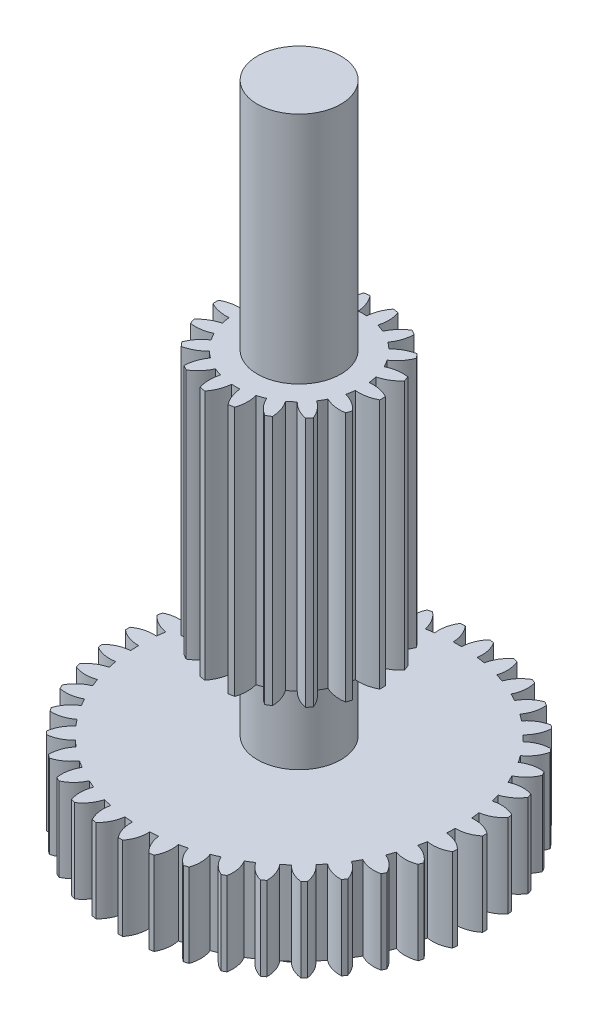
from build123d import *

# Parameters (mm, degrees)
BOSS_EXTRUDE1_DEPTH      = 1
BOSS_EXTRUDE2_DEPTH      = 6.8
BOSS_EXTRUDE2_DEPTH_BACK = 2
SKETCH2_R                = 0.5
SKETCH3_R                = 1
BOSS_EXTRUDE3_DEPTH      = 3
SKETCH4_OUTSIDE_W        = 8.414
SKETCH4_OUTSIDE_H        = 8.411
CUT_EXTRUDE1_DEPTH       = 3


with BuildPart() as part:
    # Sketch1 → Boss-Extrude1 (new body)
    with BuildSketch(Plane(origin=(0, 0, 0), x_dir=(1, 0, 0), z_dir=(0, 1, 0))):
        with BuildLine():
            ThreePointArc((-1.398553175, 1.619768198), (-1.419082489, 1.601813001), (-1.439381308, 1.583597629))
            ThreePointArc((-1.439381308, 1.583597629), (-1.407018105, 1.456632634), (-1.332288063, 1.349008716))
            ThreePointArc((-1.332288063, 1.349008716), (-1.36739984, 1.313405374), (-1.401560499, 1.276888471))
            ThreePointArc((-1.401560499, 1.276888471), (-1.512106209, 1.347224329), (-1.64027137, 1.374448919))
            ThreePointArc((-1.64027137, 1.374448919), (-1.657654618, 1.353433104), (-1.674768622, 1.332197457))
            ThreePointArc((-1.674768622, 1.332197457), (-1.622457897, 1.212068048), (-1.531431499, 1.117825373))
            ThreePointArc((-1.531431499, 1.117825373), (-1.56037741, 1.07705076), (-1.588237974, 1.035526986))
            ThreePointArc((-1.588237974, 1.035526986), (-1.708634811, 1.087219234), (-1.839507398, 1.093532136))
            ThreePointArc((-1.839507398, 1.093532136), (-1.853294364, 1.07), (-1.866780308, 1.04629407))
            ThreePointArc((-1.866780308, 1.04629407), (-1.795876881, 0.936111535), (-1.690911663, 0.857690939))
            ThreePointArc((-1.690911663, 0.857690939), (-1.712942024, 0.812801096), (-1.733780919, 0.767345896))
            ThreePointArc((-1.733780919, 0.767345896), (-1.860910669, 0.799055731), (-1.991101151, 0.784293444))
            ThreePointArc((-1.991101151, 0.784293444), (-2.000934759, 0.758854458), (-2.010443366, 0.733292216))
            ThreePointArc((-2.010443366, 0.733292216), (-1.922783598, 0.635910226), (-1.806598103, 0.575342761))
            ThreePointArc((-1.806598103, 0.575342761), (-1.82114234, 0.527500312), (-1.83441985, 0.47929095))
            ThreePointArc((-1.83441985, 0.47929095), (-1.964989918, 0.490197106), (-2.09112643, 0.454741964))
            ThreePointArc((-2.09112643, 0.454741964), (-2.096751995, 0.428054985), (-2.102036996, 0.401298479))
            ThreePointArc((-2.102036996, 0.401298479), (-1.999891229, 0.319239176), (-1.875494602, 0.278093508))
            ThreePointArc((-1.875494602, 0.278093508), (-1.882176025, 0.228537546), (-1.88754827, 0.17882262))
            ThreePointArc((-1.88754827, 0.17882262), (-2.01817696, 0.168642632), (-2.136992633, 0.113412905))
            ThreePointArc((-2.136992633, 0.113412905), (-2.138264456, 0.086169112), (-2.139188972, 0.058911322))
            ThreePointArc((-2.139188972, 0.058911322), (-2.025202728, -0.005700001), (-1.895816775, -0.026358221))
            ThreePointArc((-1.895816775, -0.026358221), (-1.894462341, -0.076344222), (-1.891790181, -0.126277121))
            ThreePointArc((-1.891790181, -0.126277121), (-2.019094279, -0.157279597), (-2.127511849, -0.230853487))
            ThreePointArc((-2.127511849, -0.230853487), (-2.124396991, -0.257948496), (-2.120937077, -0.285001607))
            ThreePointArc((-2.120937077, -0.285001607), (-1.99806254, -0.330491551), (-1.86703829, -0.330127286))
            ThreePointArc((-1.86703829, -0.330127286), (-1.857683076, -0.379248715), (-1.84703572, -0.428106352))
            ThreePointArc((-1.84703572, -0.428106352), (-1.967718117, -0.479128367), (-2.062929626, -0.569140896))
            ThreePointArc((-2.062929626, -0.569140896), (-2.055508759, -0.595385373), (-2.047754026, -0.621533144))
            ThreePointArc((-2.047754026, -0.621533144), (-1.919173582, -0.646723544), (-1.789904493, -0.625346228))
            ThreePointArc((-1.789904493, -0.625346228), (-1.772790796, -0.672330866), (-1.754444005, -0.718847852))
            ThreePointArc((-1.754444005, -0.718847852), (-1.865379089, -0.788567964), (-1.944918609, -0.892687854))
            ThreePointArc((-1.944918609, -0.892687854), (-1.93338393, -0.917402081), (-1.921535221, -0.941967299))
            ThreePointArc((-1.921535221, -0.941967299), (-1.790579036, -0.946205736), (-1.666413111, -0.904369031))
            ThreePointArc((-1.666413111, -0.904369031), (-1.641984166, -0.948), (-1.616413111, -0.990971572))
            ThreePointArc((-1.616413111, -0.990971572), (-1.714727723, -1.077584065), (-1.776535221, -1.193114666))
            ThreePointArc((-1.776535221, -1.193114666), (-1.761185473, -1.215658558), (-1.745549664, -1.238004996))
            ThreePointArc((-1.745549664, -1.238004996), (-1.615609434, -1.221181697), (-1.499762504, -1.159969151))
            ThreePointArc((-1.499762504, -1.159969151), (-1.468651008, -1.199116432), (-1.436517966, -1.237429647))
            ThreePointArc((-1.436517966, -1.237429647), (-1.519665809, -1.338691304), (-1.562140505, -1.462640435))
            ThreePointArc((-1.562140505, -1.462640435), (-1.543373237, -1.482430117), (-1.524355287, -1.501979014))
            ThreePointArc((-1.524355287, -1.501979014), (-1.398796396, -1.464529693), (-1.294268836, -1.38552668))
            ThreePointArc((-1.294268836, -1.38552668), (-1.25728056, -1.419176379), (-1.219417761, -1.451838945))
            ThreePointArc((-1.219417761, -1.451838945), (-1.285245349, -1.565127142), (-1.30728717, -1.694284585))
            ThreePointArc((-1.30728717, -1.694284585), (-1.285588445, -1.710807514), (-1.263680909, -1.727052564))
            ThreePointArc((-1.263680909, -1.727052564), (-1.145755266, -1.66994714), (-1.055254285, -1.575199795))
            ThreePointArc((-1.055254285, -1.575199795), (-1.013347206, -1.602480402), (-0.970735277, -1.628646377))
            ThreePointArc((-0.970735277, -1.628646377), (-1.01753771, -1.75102701), (-1.018575784, -1.882047654))
            ThreePointArc((-1.018575784, -1.882047654), (-0.994507588, -1.894875895), (-0.970277859, -1.90739636))
            ThreePointArc((-0.970277859, -1.90739636), (-0.863039676, -1.832113833), (-0.788909203, -1.724076063))
            ThreePointArc((-0.788909203, -1.724076063), (-0.743168692, -1.744281025), (-0.696911258, -1.763272724))
            ThreePointArc((-0.696911258, -1.763272724), (-0.723476378, -1.891576197), (-0.703483821, -2.021066677))
            ThreePointArc((-0.703483821, -2.021066677), (-0.677669507, -2.029867986), (-0.651745122, -2.038339593))
            ThreePointArc((-0.651745122, -2.038339593), (-0.557971812, -1.94682974), (-0.502131786, -1.828299666))
            ThreePointArc((-0.502131786, -1.828299666), (-0.453742499, -1.840905686), (-0.405037604, -1.852231233))
            ThreePointArc((-0.405037604, -1.852231233), (-0.410677389, -1.983134555), (-0.370171995, -2.107741135))
            ThreePointArc((-0.370171995, -2.107741135), (-0.343280141, -2.112287562), (-0.316332529, -2.1164909))
            ThreePointArc((-0.316332529, -2.1164909), (-0.238452772, -2.011123779), (-0.20234942, -1.885171269))
            ThreePointArc((-0.20234942, -1.885171269), (-0.152564614, -1.889851856), (-0.102673689, -1.893217926))
            ThreePointArc((-0.102673689, -1.893217926), (-0.08724207, -2.023330769), (-0.02727291, -2.139826205))
            ThreePointArc((-0.02727291, -2.139826205), (0, -2.14), (0.02727291, -2.139826205))
            ThreePointArc((0.02727291, -2.139826205), (0.08724207, -2.023330769), (0.102673689, -1.893217926))
            ThreePointArc((0.102673689, -1.893217926), (0.152564614, -1.889851856), (0.20234942, -1.885171269))
            ThreePointArc((0.20234942, -1.885171269), (0.238452772, -2.011123779), (0.316332529, -2.1164909))
            ThreePointArc((0.316332529, -2.1164909), (0.343280141, -2.112287562), (0.370171995, -2.107741135))
            ThreePointArc((0.370171995, -2.107741135), (0.410677389, -1.983134555), (0.405037604, -1.852231233))
            ThreePointArc((0.405037604, -1.852231233), (0.453742499, -1.840905686), (0.502131786, -1.828299666))
            ThreePointArc((0.502131786, -1.828299666), (0.557971812, -1.94682974), (0.651745122, -2.038339593))
            ThreePointArc((0.651745122, -2.038339593), (0.677669507, -2.029867986), (0.703483821, -2.021066677))
            ThreePointArc((0.703483821, -2.021066677), (0.723476378, -1.891576197), (0.696911258, -1.763272724))
            ThreePointArc((0.696911258, -1.763272724), (0.743168692, -1.744281025), (0.788909203, -1.724076063))
            ThreePointArc((0.788909203, -1.724076063), (0.863039676, -1.832113833), (0.970277859, -1.90739636))
            ThreePointArc((0.970277859, -1.90739636), (0.994507588, -1.894875895), (1.018575784, -1.882047654))
            ThreePointArc((1.018575784, -1.882047654), (1.01753771, -1.75102701), (0.970735277, -1.628646377))
            ThreePointArc((0.970735277, -1.628646377), (1.013347206, -1.602480402), (1.055254285, -1.575199795))
            ThreePointArc((1.055254285, -1.575199795), (1.145755266, -1.66994714), (1.263680909, -1.727052564))
            ThreePointArc((1.263680909, -1.727052564), (1.285588445, -1.710807514), (1.30728717, -1.694284585))
            ThreePointArc((1.30728717, -1.694284585), (1.285245349, -1.565127142), (1.219417761, -1.451838945))
            ThreePointArc((1.219417761, -1.451838945), (1.25728056, -1.419176379), (1.294268836, -1.38552668))
            ThreePointArc((1.294268836, -1.38552668), (1.398796396, -1.464529693), (1.524355287, -1.501979014))
            ThreePointArc((1.524355287, -1.501979014), (1.543373237, -1.482430117), (1.562140505, -1.462640435))
            ThreePointArc((1.562140505, -1.462640435), (1.519665809, -1.338691304), (1.436517966, -1.237429647))
            ThreePointArc((1.436517966, -1.237429647), (1.468651008, -1.199116432), (1.499762504, -1.159969151))
            ThreePointArc((1.499762504, -1.159969151), (1.615609434, -1.221181697), (1.745549664, -1.238004996))
            ThreePointArc((1.745549664, -1.238004996), (1.761185473, -1.215658558), (1.776535221, -1.193114666))
            ThreePointArc((1.776535221, -1.193114666), (1.714727723, -1.077584065), (1.616413111, -0.990971572))
            ThreePointArc((1.616413111, -0.990971572), (1.641984166, -0.948), (1.666413111, -0.904369031))
            ThreePointArc((1.666413111, -0.904369031), (1.790579036, -0.946205736), (1.921535221, -0.941967299))
            ThreePointArc((1.921535221, -0.941967299), (1.93338393, -0.917402081), (1.944918609, -0.892687854))
            ThreePointArc((1.944918609, -0.892687854), (1.865379089, -0.788567964), (1.754444005, -0.718847852))
            ThreePointArc((1.754444005, -0.718847852), (1.772790796, -0.672330866), (1.789904493, -0.625346228))
            ThreePointArc((1.789904493, -0.625346228), (1.919173582, -0.646723544), (2.047754026, -0.621533144))
            ThreePointArc((2.047754026, -0.621533144), (2.055508759, -0.595385373), (2.062929626, -0.569140896))
            ThreePointArc((2.062929626, -0.569140896), (1.967718117, -0.479128367), (1.84703572, -0.428106352))
            ThreePointArc((1.84703572, -0.428106352), (1.857683076, -0.379248715), (1.86703829, -0.330127286))
            ThreePointArc((1.86703829, -0.330127286), (1.99806254, -0.330491551), (2.120937077, -0.285001607))
            ThreePointArc((2.120937077, -0.285001607), (2.124396991, -0.257948496), (2.127511849, -0.230853487))
            ThreePointArc((2.127511849, -0.230853487), (2.019094279, -0.157279597), (1.891790181, -0.126277121))
            ThreePointArc((1.891790181, -0.126277121), (1.894462341, -0.076344222), (1.895816775, -0.026358221))
            ThreePointArc((1.895816775, -0.026358221), (2.025202728, -0.005700001), (2.139188972, 0.058911322))
            ThreePointArc((2.139188972, 0.058911322), (2.138264456, 0.086169112), (2.136992633, 0.113412905))
            ThreePointArc((2.136992633, 0.113412905), (2.01817696, 0.168642632), (1.88754827, 0.17882262))
            ThreePointArc((1.88754827, 0.17882262), (1.882176025, 0.228537546), (1.875494602, 0.278093508))
            ThreePointArc((1.875494602, 0.278093508), (1.999891229, 0.319239176), (2.102036996, 0.401298479))
            ThreePointArc((2.102036996, 0.401298479), (2.096751995, 0.428054985), (2.09112643, 0.454741964))
            ThreePointArc((2.09112643, 0.454741964), (1.964989918, 0.490197106), (1.83441985, 0.47929095))
            ThreePointArc((1.83441985, 0.47929095), (1.82114234, 0.527500312), (1.806598103, 0.575342761))
            ThreePointArc((1.806598103, 0.575342761), (1.922783598, 0.635910226), (2.010443366, 0.733292216))
            ThreePointArc((2.010443366, 0.733292216), (2.000934759, 0.758854458), (1.991101151, 0.784293444))
            ThreePointArc((1.991101151, 0.784293444), (1.860910669, 0.799055731), (1.733780919, 0.767345896))
            ThreePointArc((1.733780919, 0.767345896), (1.712942024, 0.812801096), (1.690911663, 0.857690939))
            ThreePointArc((1.690911663, 0.857690939), (1.795876881, 0.936111535), (1.866780308, 1.04629407))
            ThreePointArc((1.866780308, 1.04629407), (1.853294364, 1.07), (1.839507398, 1.093532136))
            ThreePointArc((1.839507398, 1.093532136), (1.708634811, 1.087219234), (1.588237974, 1.035526986))
            ThreePointArc((1.588237974, 1.035526986), (1.56037741, 1.07705076), (1.531431499, 1.117825373))
            ThreePointArc((1.531431499, 1.117825373), (1.622457897, 1.212068048), (1.674768622, 1.332197457))
            ThreePointArc((1.674768622, 1.332197457), (1.657654618, 1.353433104), (1.64027137, 1.374448919))
            ThreePointArc((1.64027137, 1.374448919), (1.512106209, 1.347224329), (1.401560499, 1.276888471))
            ThreePointArc((1.401560499, 1.276888471), (1.36739984, 1.313405374), (1.332288063, 1.349008716))
            ThreePointArc((1.332288063, 1.349008716), (1.407018105, 1.456632634), (1.439381308, 1.583597629))
            ThreePointArc((1.439381308, 1.583597629), (1.419082489, 1.601813001), (1.398553175, 1.619768198))
            ThreePointArc((1.398553175, 1.619768198), (1.276414851, 1.572337021), (1.178583343, 1.485179216))
            ThreePointArc((1.178583343, 1.485179216), (1.139007333, 1.515743479), (1.098639067, 1.545253442))
            ThreePointArc((1.098639067, 1.545253442), (1.155137284, 1.6634712), (1.166714774, 1.793983455))
            ThreePointArc((1.166714774, 1.793983455), (1.143756868, 1.808706783), (1.120613187, 1.823136332))
            ThreePointArc((1.120613187, 1.823136332), (1.007665018, 1.756727011), (0.925081498, 1.655004599))
            ThreePointArc((0.925081498, 1.655004599), (0.881115134, 1.678824625), (0.836535896, 1.701476916))
            ThreePointArc((0.836535896, 1.701476916), (0.873339013, 1.827226737), (0.86383094, 1.957906052))
            ThreePointArc((0.86383094, 1.957906052), (0.838808545, 1.968756009), (0.813649907, 1.979286192))
            ThreePointArc((0.813649907, 1.979286192), (0.712817191, 1.895618694), (0.647620528, 1.781966232))
            ThreePointArc((0.647620528, 1.781966232), (0.600402516, 1.798425094), (0.552766884, 1.813633031))
            ThreePointArc((0.552766884, 1.813633031), (0.568921721, 1.94365806), (0.538574339, 2.07111991))
            ThreePointArc((0.538574339, 2.07111991), (0.512135522, 2.077815489), (0.485613521, 2.084173579))
            ThreePointArc((0.485613521, 2.084173579), (0.399507773, 1.985414848), (0.353386527, 1.862775876))
            ThreePointArc((0.353386527, 1.862775876), (0.304139789, 1.871447298), (0.254681501, 1.878817004))
            ThreePointArc((0.254681501, 1.878817004), (0.249769655, 2.009749661), (0.199368945, 2.130692851))
            ThreePointArc((0.199368945, 2.130692851), (0.172198457, 2.133060639), (0.145, 2.135081966))
            ThreePointArc((0.145, 2.135081966), (0.075851313, 2.023789801), (0.05, 1.895340603))
            ThreePointArc((0.05, 1.895340603), (0, 1.896), (-0.05, 1.895340603))
            ThreePointArc((-0.05, 1.895340603), (-0.075851313, 2.023789801), (-0.145, 2.135081966))
            ThreePointArc((-0.145, 2.135081966), (-0.172198457, 2.133060639), (-0.199368945, 2.130692851))
            ThreePointArc((-0.199368945, 2.130692851), (-0.249769655, 2.009749661), (-0.254681501, 1.878817004))
            ThreePointArc((-0.254681501, 1.878817004), (-0.304139789, 1.871447298), (-0.353386527, 1.862775876))
            ThreePointArc((-0.353386527, 1.862775876), (-0.399507773, 1.985414848), (-0.485613521, 2.084173579))
            ThreePointArc((-0.485613521, 2.084173579), (-0.512135522, 2.077815489), (-0.538574339, 2.07111991))
            ThreePointArc((-0.538574339, 2.07111991), (-0.568921721, 1.94365806), (-0.552766884, 1.813633031))
            ThreePointArc((-0.552766884, 1.813633031), (-0.600402516, 1.798425094), (-0.647620528, 1.781966232))
            ThreePointArc((-0.647620528, 1.781966232), (-0.712817191, 1.895618694), (-0.813649907, 1.979286192))
            ThreePointArc((-0.813649907, 1.979286192), (-0.838808545, 1.968756009), (-0.86383094, 1.957906052))
            ThreePointArc((-0.86383094, 1.957906052), (-0.873339013, 1.827226737), (-0.836535896, 1.701476916))
            ThreePointArc((-0.836535896, 1.701476916), (-0.881115134, 1.678824625), (-0.925081498, 1.655004599))
            ThreePointArc((-0.925081498, 1.655004599), (-1.007665018, 1.756727011), (-1.120613187, 1.823136332))
            ThreePointArc((-1.120613187, 1.823136332), (-1.143756868, 1.808706783), (-1.166714774, 1.793983455))
            ThreePointArc((-1.166714774, 1.793983455), (-1.155137284, 1.6634712), (-1.098639067, 1.545253442))
            ThreePointArc((-1.098639067, 1.545253442), (-1.139007333, 1.515743479), (-1.178583343, 1.485179216))
            ThreePointArc((-1.178583343, 1.485179216), (-1.276414851, 1.572337021), (-1.398553175, 1.619768198))
        make_face()
    extrude(amount=BOSS_EXTRUDE1_DEPTH)

    # Sketch2 → Boss-Extrude2 (add, two sides: drawn at the far end of the back side and taken through both)
    with BuildSketch(Plane(origin=(0, 1, 0), x_dir=(1, 0, 0), z_dir=(0, 1, 0)).offset(-BOSS_EXTRUDE2_DEPTH_BACK)):
        with Locations(Location((0, 0, 0), (0, 0, 270))):
            Circle(SKETCH2_R)
    extrude(amount=BOSS_EXTRUDE2_DEPTH + BOSS_EXTRUDE2_DEPTH_BACK)

    # Sketch3 → Boss-Extrude3 (add)
    with BuildSketch(Plane(origin=(0, 2, 0), x_dir=(1, 0, 0), z_dir=(0, 1, 0))):
        with Locations(Location((0, 0, 0), (0, 0, 270))):
            Circle(SKETCH3_R)
    extrude(amount=BOSS_EXTRUDE3_DEPTH)

    # Sketch4 outside → Cut-Extrude1 (cut)
    with BuildSketch(Plane(origin=(0, 5, 0), x_dir=(1, 0, 0), z_dir=(0, 1, 0))):
        with Locations((0, -0.0025)):
            Rectangle(SKETCH4_OUTSIDE_W, SKETCH4_OUTSIDE_H)
        with BuildLine():
            ThreePointArc((-0.631753378, 0.42247801), (-0.658179307, 0.38), (-0.681753378, 0.33587547))
            ThreePointArc((-0.681753378, 0.33587547), (-0.801755606, 0.373430271), (-0.927496356, 0.373832195))
            ThreePointArc((-0.927496356, 0.373832195), (-0.939692621, 0.342020143), (-0.950798132, 0.30981109))
            ThreePointArc((-0.950798132, 0.30981109), (-0.854216778, 0.229294386), (-0.738149977, 0.180927087))
            ThreePointArc((-0.738149977, 0.180927087), (-0.748453892, 0.131972615), (-0.755514795, 0.082446312))
            ThreePointArc((-0.755514795, 0.082446312), (-0.881124501, 0.076693102), (-0.999419622, 0.034064919))
            ThreePointArc((-0.999419622, 0.034064919), (-1, 0), (-0.999419622, -0.034064919))
            ThreePointArc((-0.999419622, -0.034064919), (-0.881124501, -0.076693102), (-0.755514795, -0.082446312))
            ThreePointArc((-0.755514795, -0.082446312), (-0.748453892, -0.131972615), (-0.738149977, -0.180927087))
            ThreePointArc((-0.738149977, -0.180927087), (-0.854216778, -0.229294386), (-0.950798132, -0.30981109))
            ThreePointArc((-0.950798132, -0.30981109), (-0.939692621, -0.342020143), (-0.927496356, -0.373832195))
            ThreePointArc((-0.927496356, -0.373832195), (-0.801755606, -0.373430271), (-0.681753378, -0.33587547))
            ThreePointArc((-0.681753378, -0.33587547), (-0.658179307, -0.38), (-0.631753378, -0.42247801))
            ThreePointArc((-0.631753378, -0.42247801), (-0.724277904, -0.507625587), (-0.787496356, -0.616319308))
            ThreePointArc((-0.787496356, -0.616319308), (-0.766044443, -0.64278761), (-0.74370334, -0.668509792))
            ThreePointArc((-0.74370334, -0.668509792), (-0.625683152, -0.625126237), (-0.525762443, -0.548793088))
            ThreePointArc((-0.525762443, -0.548793088), (-0.488518583, -0.582193777), (-0.449157998, -0.613071849))
            ThreePointArc((-0.449157998, -0.613071849), (-0.506980426, -0.724729651), (-0.529210896, -0.848490323))
            ThreePointArc((-0.529210896, -0.848490323), (-0.5, -0.866025404), (-0.470208726, -0.882555241))
            ThreePointArc((-0.470208726, -0.882555241), (-0.374144076, -0.801422753), (-0.306356797, -0.695518162))
            ThreePointArc((-0.306356797, -0.695518162), (-0.259935309, -0.714166392), (-0.212387535, -0.729720176))
            ThreePointArc((-0.212387535, -0.729720176), (-0.228533626, -0.854420623), (-0.207094792, -0.978320881))
            ThreePointArc((-0.207094792, -0.978320881), (-0.173648178, -0.984807753), (-0.14, -0.990151504))
            ThreePointArc((-0.14, -0.990151504), (-0.077477702, -0.881055858), (-0.05, -0.75835348))
            ThreePointArc((-0.05, -0.75835348), (0, -0.76), (0.05, -0.75835348))
            ThreePointArc((0.05, -0.75835348), (0.077477702, -0.881055858), (0.14, -0.990151504))
            ThreePointArc((0.14, -0.990151504), (0.173648178, -0.984807753), (0.207094792, -0.978320881))
            ThreePointArc((0.207094792, -0.978320881), (0.228533626, -0.854420623), (0.212387535, -0.729720176))
            ThreePointArc((0.212387535, -0.729720176), (0.259935309, -0.714166392), (0.306356797, -0.695518162))
            ThreePointArc((0.306356797, -0.695518162), (0.374144076, -0.801422753), (0.470208726, -0.882555241))
            ThreePointArc((0.470208726, -0.882555241), (0.5, -0.866025404), (0.529210896, -0.848490323))
            ThreePointArc((0.529210896, -0.848490323), (0.506980426, -0.724729651), (0.449157998, -0.613071849))
            ThreePointArc((0.449157998, -0.613071849), (0.488518583, -0.582193777), (0.525762443, -0.548793088))
            ThreePointArc((0.525762443, -0.548793088), (0.625683152, -0.625126237), (0.74370334, -0.668509792))
            ThreePointArc((0.74370334, -0.668509792), (0.766044443, -0.64278761), (0.787496356, -0.616319308))
            ThreePointArc((0.787496356, -0.616319308), (0.724277904, -0.507625587), (0.631753378, -0.42247801))
            ThreePointArc((0.631753378, -0.42247801), (0.658179307, -0.38), (0.681753378, -0.33587547))
            ThreePointArc((0.681753378, -0.33587547), (0.801755606, -0.373430271), (0.927496356, -0.373832195))
            ThreePointArc((0.927496356, -0.373832195), (0.939692621, -0.342020143), (0.950798132, -0.30981109))
            ThreePointArc((0.950798132, -0.30981109), (0.854216778, -0.229294386), (0.738149977, -0.180927087))
            ThreePointArc((0.738149977, -0.180927087), (0.748453892, -0.131972615), (0.755514795, -0.082446312))
            ThreePointArc((0.755514795, -0.082446312), (0.881124501, -0.076693102), (0.999419622, -0.034064919))
            ThreePointArc((0.999419622, -0.034064919), (1, 0), (0.999419622, 0.034064919))
            ThreePointArc((0.999419622, 0.034064919), (0.881124501, 0.076693102), (0.755514795, 0.082446312))
            ThreePointArc((0.755514795, 0.082446312), (0.748453892, 0.131972615), (0.738149977, 0.180927087))
            ThreePointArc((0.738149977, 0.180927087), (0.854216778, 0.229294386), (0.950798132, 0.30981109))
            ThreePointArc((0.950798132, 0.30981109), (0.939692621, 0.342020143), (0.927496356, 0.373832195))
            ThreePointArc((0.927496356, 0.373832195), (0.801755606, 0.373430271), (0.681753378, 0.33587547))
            ThreePointArc((0.681753378, 0.33587547), (0.658179307, 0.38), (0.631753378, 0.42247801))
            ThreePointArc((0.631753378, 0.42247801), (0.724277904, 0.507625587), (0.787496356, 0.616319308))
            ThreePointArc((0.787496356, 0.616319308), (0.766044443, 0.64278761), (0.74370334, 0.668509792))
            ThreePointArc((0.74370334, 0.668509792), (0.625683152, 0.625126237), (0.525762443, 0.548793088))
            ThreePointArc((0.525762443, 0.548793088), (0.488518583, 0.582193777), (0.449157998, 0.613071849))
            ThreePointArc((0.449157998, 0.613071849), (0.506980426, 0.724729651), (0.529210896, 0.848490323))
            ThreePointArc((0.529210896, 0.848490323), (0.5, 0.866025404), (0.470208726, 0.882555241))
            ThreePointArc((0.470208726, 0.882555241), (0.374144076, 0.801422753), (0.306356797, 0.695518162))
            ThreePointArc((0.306356797, 0.695518162), (0.259935309, 0.714166392), (0.212387535, 0.729720176))
            ThreePointArc((0.212387535, 0.729720176), (0.228533626, 0.854420623), (0.207094792, 0.978320881))
            ThreePointArc((0.207094792, 0.978320881), (0.173648178, 0.984807753), (0.14, 0.990151504))
            ThreePointArc((0.14, 0.990151504), (0.077477702, 0.881055858), (0.05, 0.75835348))
            ThreePointArc((0.05, 0.75835348), (0, 0.76), (-0.05, 0.75835348))
            ThreePointArc((-0.05, 0.75835348), (-0.077477702, 0.881055858), (-0.14, 0.990151504))
            ThreePointArc((-0.14, 0.990151504), (-0.173648178, 0.984807753), (-0.207094792, 0.978320881))
            ThreePointArc((-0.207094792, 0.978320881), (-0.228533626, 0.854420623), (-0.212387535, 0.729720176))
            ThreePointArc((-0.212387535, 0.729720176), (-0.259935309, 0.714166392), (-0.306356797, 0.695518162))
            ThreePointArc((-0.306356797, 0.695518162), (-0.374144076, 0.801422753), (-0.470208726, 0.882555241))
            ThreePointArc((-0.470208726, 0.882555241), (-0.5, 0.866025404), (-0.529210896, 0.848490323))
            ThreePointArc((-0.529210896, 0.848490323), (-0.506980426, 0.724729651), (-0.449157998, 0.613071849))
            ThreePointArc((-0.449157998, 0.613071849), (-0.488518583, 0.582193777), (-0.525762443, 0.548793088))
            ThreePointArc((-0.525762443, 0.548793088), (-0.625683152, 0.625126237), (-0.74370334, 0.668509792))
            ThreePointArc((-0.74370334, 0.668509792), (-0.766044443, 0.64278761), (-0.787496356, 0.616319308))
            ThreePointArc((-0.787496356, 0.616319308), (-0.724277904, 0.507625587), (-0.631753378, 0.42247801))
        make_face(mode=Mode.SUBTRACT)
    extrude(amount=-CUT_EXTRUDE1_DEPTH, mode=Mode.SUBTRACT)


solid = part.part
